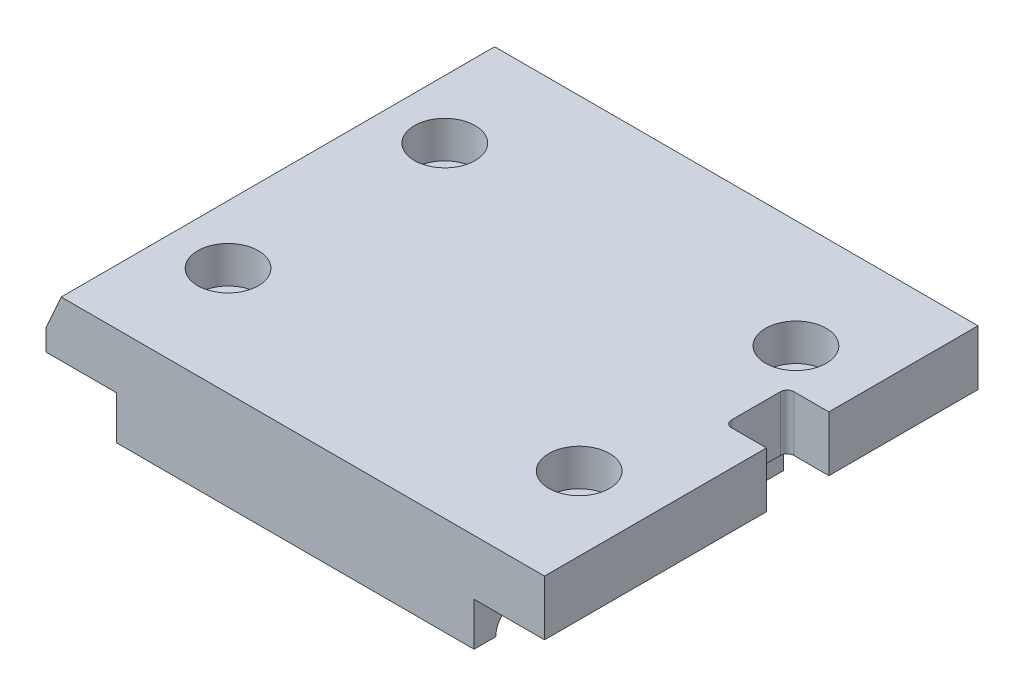
from build123d import *

# Parameters (mm, degrees)
SKETCH1_W           = 40
SKETCH1_H           = 40
SKETCH1_R           = 1.5
SKETCH1_R_2         = 2.8
BOSS_EXTRUDE1_DEPTH = 5.7
BOSS_EXTRUDE3_START = 5.7
SKETCH1_3_W         = 40
SKETCH1_3_H         = 40
SKETCH1_3_R         = 2.8
SKETCH1_3_R_2       = 1.5
BOSS_EXTRUDE3_DEPTH = 3.4
SKETCH4_W           = 3.5
SKETCH4_H           = 40
CUT_EXTRUDE2_DEPTH  = 4
SKETCH2_W           = 3
SKETCH2_H           = 40
BOSS_EXTRUDE4_DEPTH = 5.1
CUT_EXTRUDE3_START  = -39.5
SKETCH5_R           = 2
CUT_EXTRUDE3_DEPTH  = 33
CUT_EXTRUDE4_START  = -5.1
SKETCH6_W           = 3.85
SKETCH6_H           = 5.76
CUT_EXTRUDE4_DEPTH  = 5.1
FILLET1_R           = 0.62
CHAMFER1_SIZE       = 1.4
CHAMFER1_SIZE2      = 3.144451483


with BuildPart() as part:
    # Sketch1 → Boss-Extrude1 (new body)
    # profile 1 of 7: a face of its own
    with BuildSketch(Plane(origin=(0, 0, 0), x_dir=(1, 0, 0), z_dir=(0, 1, 0))):
        Rectangle(SKETCH1_W, SKETCH1_H)
        with Locations((0, -10)):
            Circle(SKETCH1_R, mode=Mode.SUBTRACT)
        with Locations((0, 10)):
            Circle(SKETCH1_R, mode=Mode.SUBTRACT)
        with Locations(Location((-16.2, -10, 0), (0, 0, 270))):
            Circle(SKETCH1_R, mode=Mode.SUBTRACT)
        with Locations(Location((16.2, -10, 0), (0, 0, 270))):
            Circle(SKETCH1_R, mode=Mode.SUBTRACT)
        with Locations(Location((16.2, 10, 0), (0, 0, 270))):
            Circle(SKETCH1_R, mode=Mode.SUBTRACT)
        with Locations(Location((-16.2, 10, 0), (0, 0, 270))):
            Circle(SKETCH1_R, mode=Mode.SUBTRACT)
    # profile 2 of 7: a face of its own
    with BuildSketch(Plane(origin=(0, 0, 0), x_dir=(1, 0, 0), z_dir=(0, 1, 0))):
        with Locations((0, 10)):
            Circle(SKETCH1_R)
    # profile 3 of 7: a face of its own
    with BuildSketch(Plane(origin=(0, 0, 0), x_dir=(1, 0, 0), z_dir=(0, 1, 0))):
        with Locations((0, -10)):
            Circle(SKETCH1_R)
    # profile 4 of 7: a face of its own
    with BuildSketch(Plane(origin=(0, 0, 0), x_dir=(1, 0, 0), z_dir=(0, 1, 0))):
        with Locations((-16.2, 10)):
            Circle(SKETCH1_R_2)
        with Locations(Location((-16.2, 10, 0), (0, 0, 270))):
            Circle(SKETCH1_R, mode=Mode.SUBTRACT)
    # profile 5 of 7: a face of its own
    with BuildSketch(Plane(origin=(0, 0, 0), x_dir=(1, 0, 0), z_dir=(0, 1, 0))):
        with Locations((-16.2, -10)):
            Circle(SKETCH1_R_2)
        with Locations(Location((-16.2, -10, 0), (0, 0, 270))):
            Circle(SKETCH1_R, mode=Mode.SUBTRACT)
    # profile 6 of 7: a face of its own
    with BuildSketch(Plane(origin=(0, 0, 0), x_dir=(1, 0, 0), z_dir=(0, 1, 0))):
        with Locations((16.2, 10)):
            Circle(SKETCH1_R_2)
        with Locations(Location((16.2, 10, 0), (0, 0, 270))):
            Circle(SKETCH1_R, mode=Mode.SUBTRACT)
    # profile 7 of 7: a face of its own
    with BuildSketch(Plane(origin=(0, 0, 0), x_dir=(1, 0, 0), z_dir=(0, 1, 0))):
        with Locations((16.2, -10)):
            Circle(SKETCH1_R_2)
        with Locations(Location((16.2, -10, 0), (0, 0, 270))):
            Circle(SKETCH1_R, mode=Mode.SUBTRACT)
    extrude(amount=BOSS_EXTRUDE1_DEPTH)

    # Sketch1_3 → Boss-Extrude3 (add)
    # profile 1 of 3: a face of its own
    with BuildSketch(Plane(origin=(0, 0, 0), x_dir=(1, 0, 0), z_dir=(0, 1, 0)).offset(BOSS_EXTRUDE3_START)):
        Rectangle(SKETCH1_3_W, SKETCH1_3_H)
        with Locations(Location((16.2, 10, 0), (0, 0, 270))):
            Circle(SKETCH1_3_R, mode=Mode.SUBTRACT)
        with Locations(Location((-16.2, 10, 0), (0, 0, 270))):
            Circle(SKETCH1_3_R, mode=Mode.SUBTRACT)
        with Locations((0, -10)):
            Circle(SKETCH1_3_R_2, mode=Mode.SUBTRACT)
        with Locations((0, 10)):
            Circle(SKETCH1_3_R_2, mode=Mode.SUBTRACT)
        with Locations(Location((-16.2, -10, 0), (0, 0, 270))):
            Circle(SKETCH1_3_R, mode=Mode.SUBTRACT)
        with Locations(Location((16.2, -10, 0), (0, 0, 270))):
            Circle(SKETCH1_3_R, mode=Mode.SUBTRACT)
    # profile 2 of 3: a face of its own
    with BuildSketch(Plane(origin=(0, 0, 0), x_dir=(1, 0, 0), z_dir=(0, 1, 0)).offset(BOSS_EXTRUDE3_START)):
        with Locations((0, 10)):
            Circle(SKETCH1_3_R_2)
    # profile 3 of 3: a face of its own
    with BuildSketch(Plane(origin=(0, 0, 0), x_dir=(1, 0, 0), z_dir=(0, 1, 0)).offset(BOSS_EXTRUDE3_START)):
        with Locations((0, -10)):
            Circle(SKETCH1_3_R_2)
    extrude(amount=BOSS_EXTRUDE3_DEPTH)

    # Sketch4 → Cut-Extrude2 (cut)
    with BuildSketch(Plane.XZ):
        with Locations((18.25, 0)):
            Rectangle(SKETCH4_W, SKETCH4_H)
        with Locations((-18.25, 0)):
            Rectangle(SKETCH4_W, SKETCH4_H)
    extrude(amount=-CUT_EXTRUDE2_DEPTH, mode=Mode.SUBTRACT)

    # Sketch2 → Boss-Extrude4 (add)
    with BuildSketch(Plane(origin=(0, 9.1, 0), x_dir=(1, 0, 0), z_dir=(0, 1, 0))):
        with Locations((-21.5, 0)):
            Rectangle(SKETCH2_W, SKETCH2_H)
        with Locations((21.5, 0)):
            Rectangle(SKETCH2_W, SKETCH2_H)
    extrude(amount=-BOSS_EXTRUDE4_DEPTH)

    # Sketch5 → Cut-Extrude3 (cut)
    with BuildSketch(Plane(origin=(23, 0, 0), x_dir=(0, 0, -1), z_dir=(1, 0, 0)).offset(CUT_EXTRUDE3_START)):
        with Locations((16, 0)):
            Circle(SKETCH5_R)
        with Locations((-16, 0)):
            Circle(SKETCH5_R)
    extrude(amount=CUT_EXTRUDE3_DEPTH, mode=Mode.SUBTRACT)

    # Sketch6 → Cut-Extrude4 (cut)
    with BuildSketch(Plane(origin=(0, 9.1, 0), x_dir=(1, 0, 0), z_dir=(0, 1, 0)).offset(CUT_EXTRUDE4_START)):
        with Locations((21.075, 3.36)):
            Rectangle(SKETCH6_W, SKETCH6_H)
    extrude(amount=CUT_EXTRUDE4_DEPTH, mode=Mode.SUBTRACT)

    # Fillet1
    fillet1_edges = [part.edges().sort_by_distance(p)[0] for p in [
        (19.15, 6.55, -0.48),
        (19.15, 6.55, -6.24),
    ]]
    fillet(fillet1_edges, radius=FILLET1_R)

    # Chamfer1
    chamfer1_edges = [part.edges().sort_by_distance(p)[0] for p in [
        (-23, 9.1, 0),
    ]]
    chamfer1_side = [part.faces().sort_by_distance(p)[0] for p in [
        (-0.269953671, 9.1, 0.043011548),
    ]]
    chamfer(chamfer1_edges, length=CHAMFER1_SIZE, length2=CHAMFER1_SIZE2, reference=chamfer1_side[0])


solid = part.part
